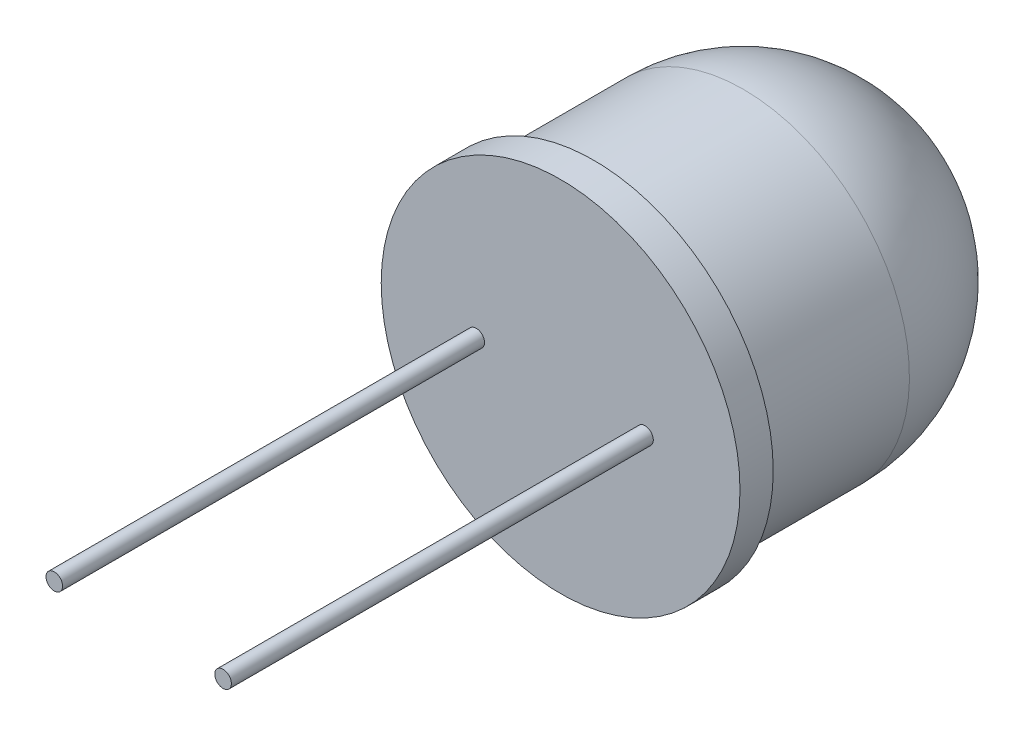
from build123d import *

# Parameters (mm, degrees)
SKETCH_1_R      = 5
EXTRUDE_1_DEPTH = 5.5
SKETCH_2_R      = 5.4
EXTRUDE_2_DEPTH = 1
SKETCH_3_R      = 0.25
EXTRUDE_3_DEPTH = 12.7


with BuildPart() as part:
    # 草图1 → 拉伸1 (new body)
    with BuildSketch(Plane.XY):
        Circle(SKETCH_1_R)
    extrude(amount=EXTRUDE_1_DEPTH)

    # 草图2 → 拉伸2 (add)
    with BuildSketch(Plane.XY.offset(5.5)):
        Circle(SKETCH_2_R)
    extrude(amount=-EXTRUDE_2_DEPTH)

    # 草图3 → 拉伸3 (add)
    with BuildSketch(Plane(origin=(0, 0, 5.5), x_dir=(-1, 0, 0), z_dir=(0, 0, -1))):
        with Locations((-2.54, 0)):
            Circle(SKETCH_3_R)
        with Locations(Location((2.54, 0, 0), (0, 0, 180))):
            Circle(SKETCH_3_R)
    extrude(amount=-EXTRUDE_3_DEPTH)

    # 草图5 → 旋转2 (revolve)
    with BuildSketch(Plane(origin=(0, 0, 0), x_dir=(0, 0, -1), z_dir=(1, 0, 0))):
        with BuildLine():
            Line((0, 5), (0, 0))
            Line((0, 0), (5, 0))
            ThreePointArc((5, 0), (3.535533906, 3.535533906), (0, 5))
        make_face()
    revolve(axis=Axis((0, 0, -5), (0, 0, 1)))


solid = part.part
